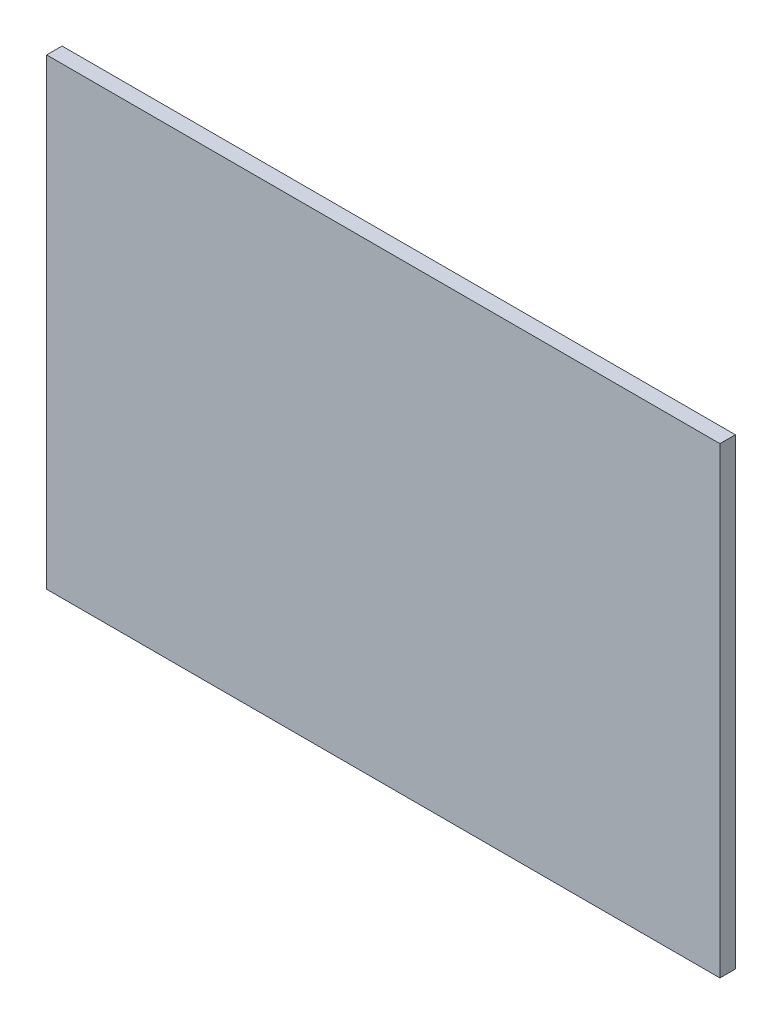
from build123d import *

# Parameters (mm, degrees)
SKETCH1_W           = 87.3
SKETCH1_H           = 60
BOSS_EXTRUDE1_DEPTH = 2


with BuildPart() as part:
    # Sketch1 → Boss-Extrude1 (new body)
    with BuildSketch(Plane.XY):
        with Locations((-8.903731343, -5.78619403)):
            Rectangle(SKETCH1_W, SKETCH1_H)
    extrude(amount=BOSS_EXTRUDE1_DEPTH)


solid = part.part
